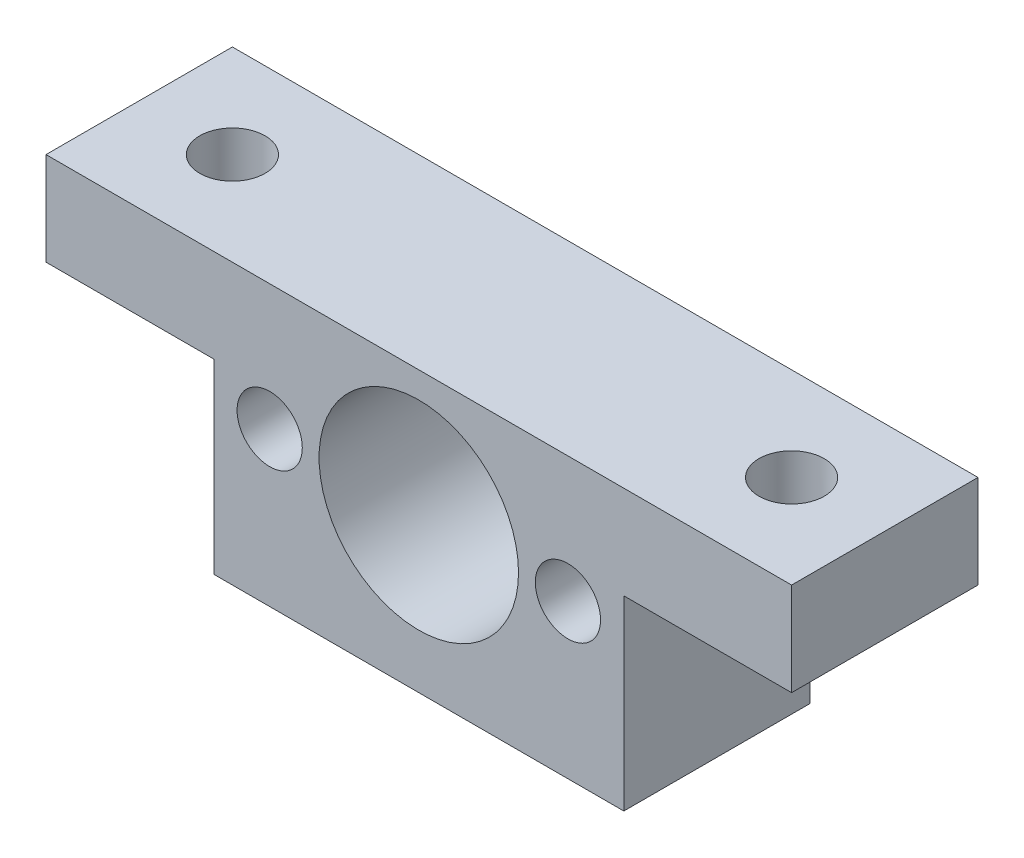
from build123d import *

# Parameters (mm, degrees)
ESBO_O1_R                = 5.35
ESBO_O1_R_2              = 1.75
RESSALTO_EXTRUS_O1_DEPTH = 10
ESBO_O2_R                = 1.75
CORTE_EXTRUS_O1_DEPTH    = 10


with BuildPart() as part:
    # Esboço1 → Ressalto-extrusão1 (new body)
    with BuildSketch(Plane.XY):
        Polygon((-11, -5), (-11, -15), (11, -15), (11, -5), (20, -5), (20, 0), (-20, 0), (-20, -5), align=None)
        with Locations((0, -6.75)):
            Circle(ESBO_O1_R, mode=Mode.SUBTRACT)
        with Locations((-8, -6.75)):
            Circle(ESBO_O1_R_2, mode=Mode.SUBTRACT)
        with Locations((8, -6.75)):
            Circle(ESBO_O1_R_2, mode=Mode.SUBTRACT)
    extrude(amount=RESSALTO_EXTRUS_O1_DEPTH)

    # Esboço2 → Corte-extrusão1 (cut)
    with BuildSketch(Plane(origin=(0, 0, 0), x_dir=(1, 0, 0), z_dir=(0, 1, 0))):
        with Locations(Location((-15, -5, 0), (0, 0, 180))):
            Circle(ESBO_O2_R)
        with Locations(Location((15, -5, 0), (0, 0, 180))):
            Circle(ESBO_O2_R)
    extrude(amount=-CORTE_EXTRUS_O1_DEPTH, mode=Mode.SUBTRACT)


solid = part.part
